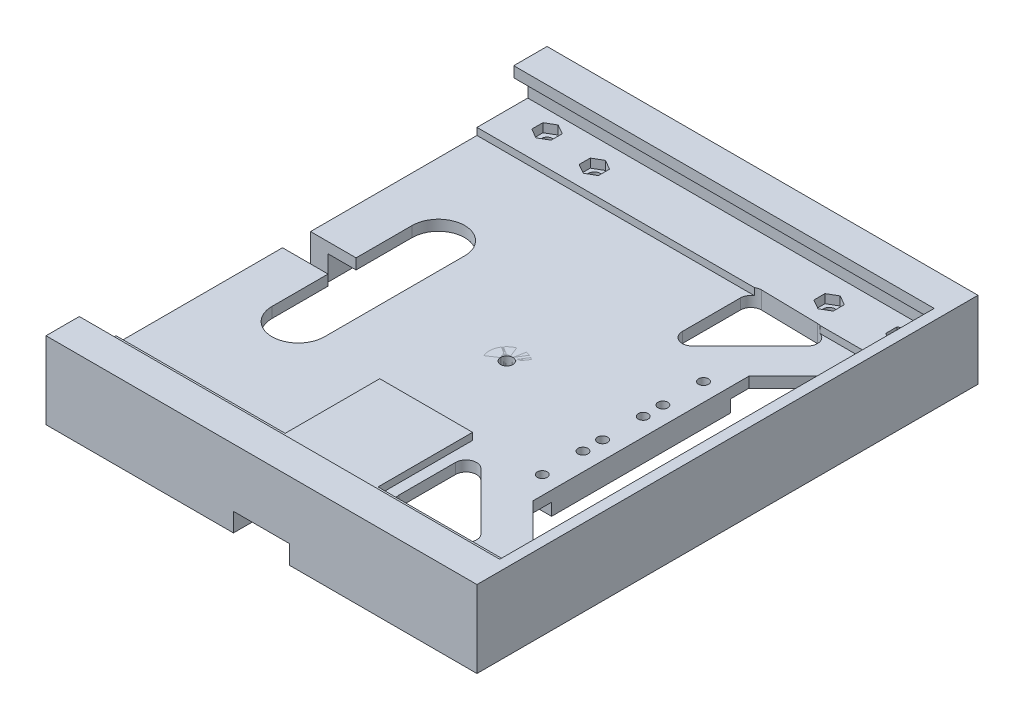
from build123d import *

# Parameters (mm, degrees)
SKETCH1_W                = 120
SKETCH1_H                = 20
BOSS_EXTRUDE1_DEPTH      = 12
SKETCH2_W                = 120
SKETCH2_H                = 9.5
BOSS_EXTRUDE2_DEPTH      = 10
CUT_EXTRUDE1_REACH       = 124.409
SKETCH3_W                = 4
SKETCH3_H                = 7
SKETCH4_W                = 76
SKETCH4_H                = 20
CUT_EXTRUDE2_DEPTH       = 7
SKETCH7_W                = 120
SKETCH7_H                = 10
BOSS_EXTRUDE3_DEPTH      = 123
SKETCH8_W                = 120
SKETCH8_H                = 20
BOSS_EXTRUDE4_DEPTH      = 2
SKETCH10_W               = 120
SKETCH10_H               = 6.5
BOSS_EXTRUDE5_DEPTH      = 7
SKETCH11_W               = 120
SKETCH11_H               = 9.5
BOSS_EXTRUDE6_DEPTH      = 3
SKETCH13_W               = 143
SKETCH13_H               = 22
BOSS_EXTRUDE7_DEPTH      = 3
CUT_EXTRUDE5_DEPTH       = 7
SKETCH16_W               = 20.8
SKETCH16_H               = 1.65
CUT_EXTRUDE6_DEPTH       = 16.5
SKETCH17_W               = 16
SKETCH17_H               = 5.35
CUT_EXTRUDE7_DEPTH       = 142.696859528
CUT_EXTRUDE8_DEPTH       = 2.75
CUT_EXTRUDE9_DEPTH       = 148.929037041
CUT_EXTRUDE9_DEPTH_BACK  = 148.929037041
SKETCH22_W               = 26.5
SKETCH22_H               = 31
BOSS_EXTRUDE8_DEPTH      = 2
CUT_EXTRUDE11_REACH      = 149.929
SKETCH27_R               = 1.75
SKETCH20_R               = 5
BOSS_EXTRUDE9_DEPTH      = 8
CUT_EXTRUDE13_DEPTH      = 2.5
CUT_EXTRUDE14_DEPTH      = 149.519359008
CUT_EXTRUDE14_DEPTH_BACK = 149.519359008
SKETCH31_R               = 1.75
SKETCH32_W               = 10.3
SKETCH32_H               = 51
BOSS_EXTRUDE10_DEPTH     = 3.5
SKETCH33_R               = 1.4
CUT_EXTRUDE15_DEPTH      = 149.324812489
SKETCH38_R               = 1.55
CUT_EXTRUDE19_DEPTH      = 12
CUT_EXTRUDE20_DEPTH      = 2.5
CUT_EXTRUDE21_DEPTH      = 148.655003302
CUT_EXTRUDE21_DEPTH_BACK = 148.655003302


with BuildPart() as part:
    # Sketch1 → Boss-Extrude1 (new body)
    with BuildSketch(Plane(origin=(0, 0, 0), x_dir=(1, 0, 0), z_dir=(0, 1, 0))):
        Rectangle(SKETCH1_W, SKETCH1_H)
    extrude(amount=BOSS_EXTRUDE1_DEPTH)

    # Sketch2 → Boss-Extrude2 (add)
    with BuildSketch(Plane(origin=(0, 12, 0), x_dir=(1, 0, 0), z_dir=(0, 1, 0))):
        with Locations((0, 5.25)):
            Rectangle(SKETCH2_W, SKETCH2_H)
    extrude(amount=BOSS_EXTRUDE2_DEPTH)

    # Sketch3 → Cut-Extrude1 (cut, up to next)
    with BuildSketch(Plane(origin=(60, 0, 0), x_dir=(0, 0, -1), z_dir=(1, 0, 0)), mode=Mode.PRIVATE) as cut_extrude1_sk1:
        with Locations((2.5, 15.5)):
            Rectangle(SKETCH3_W, SKETCH3_H)
    cut_extrude1_tool1 = extrude(cut_extrude1_sk1.sketch, amount=-CUT_EXTRUDE1_REACH, mode=Mode.PRIVATE) & part.part
    add(cut_extrude1_tool1.solids().sort_by_distance((60, 15.5, -2.5))[0], mode=Mode.SUBTRACT)

    # Sketch4 → Cut-Extrude2 (cut)
    with BuildSketch(Plane.XZ):
        Rectangle(SKETCH4_W, SKETCH4_H)
    extrude(amount=-CUT_EXTRUDE2_DEPTH, mode=Mode.SUBTRACT)

    # Sketch7 → Boss-Extrude3 (add)
    with BuildSketch(Plane.XY.offset(10)):
        with Locations((0, 5)):
            Rectangle(SKETCH7_W, SKETCH7_H)
    extrude(amount=BOSS_EXTRUDE3_DEPTH)

    # Sketch8 → Boss-Extrude4 (add)
    with BuildSketch(Plane(origin=(0, 10, 0), x_dir=(1, 0, 0), z_dir=(0, 1, 0))):
        with Locations((0, -123)):
            Rectangle(SKETCH8_W, SKETCH8_H)
    extrude(amount=BOSS_EXTRUDE4_DEPTH)



with BuildPart() as body_2:
    # Sketch10 → Boss-Extrude5 (new body)
    with BuildSketch(Plane(origin=(0, 12, 0), x_dir=(1, 0, 0), z_dir=(0, 1, 0))):
        with Locations((0, -129.75)):
            Rectangle(SKETCH10_W, SKETCH10_H)
    extrude(amount=BOSS_EXTRUDE5_DEPTH)


with BuildPart() as part_1:
    add(part.part)

    add(body_2.part)  # Boss-Extrude6 merges body 2
    # Sketch11 → Boss-Extrude6 (add)
    with BuildSketch(Plane(origin=(0, 19, 0), x_dir=(1, 0, 0), z_dir=(0, 1, 0))):
        with Locations((0, -128.25)):
            Rectangle(SKETCH11_W, SKETCH11_H)
    extrude(amount=BOSS_EXTRUDE6_DEPTH)

    # Sketch13 → Boss-Extrude7 (add)
    with BuildSketch(Plane(origin=(60, 0, 0), x_dir=(0, 0, -1), z_dir=(1, 0, 0))):
        with Locations((-61.5, 11)):
            Rectangle(SKETCH13_W, SKETCH13_H)
    extrude(amount=BOSS_EXTRUDE7_DEPTH)

    # Sketch14 → Cut-Extrude5 (cut)
    with BuildSketch(Plane.XZ):
        Polygon((-38, 10), (-55, 10), (-55, 115), (58, 115), (58, 10), (38, 10), align=None)
    extrude(amount=-CUT_EXTRUDE5_DEPTH, mode=Mode.SUBTRACT)

    # Sketch16 → Cut-Extrude6 (cut)
    with BuildSketch(Plane(origin=(0, 0, 115), x_dir=(-1, 0, 0), z_dir=(0, 0, -1))):
        with Locations((-1.5, 6.175)):
            Rectangle(SKETCH16_W, SKETCH16_H)
    extrude(amount=-CUT_EXTRUDE6_DEPTH, mode=Mode.SUBTRACT)

    # Sketch17 → Cut-Extrude7 (cut, through all)
    with BuildSketch(Plane(origin=(0, 0, 115), x_dir=(-1, 0, 0), z_dir=(0, 0, -1))):
        with Locations((-1.5, 2.675)):
            Rectangle(SKETCH17_W, SKETCH17_H)
    extrude(amount=-CUT_EXTRUDE7_DEPTH, mode=Mode.SUBTRACT)

    # Sketch18 → Cut-Extrude8 (cut)
    with BuildSketch(Plane.XZ.offset(-7)):
        Polygon((-6.5, 131.5), (9.5, 131.5), (9.5, 115), (11.75, 115), (11.75, 89), (-8.75, 89), (-8.75, 115), (-6.5, 115), align=None)
    extrude(amount=-CUT_EXTRUDE8_DEPTH, mode=Mode.SUBTRACT)

    # Sketch19 → Cut-Extrude9 (cut, two sides: drawn at the far end of the back side and taken through both)
    with BuildSketch(Plane.XZ.offset(-7).offset(-CUT_EXTRUDE9_DEPTH_BACK)):
        with BuildLine():
            Line((-47, 57.5), (-60, 57.5))
            ThreePointArc((-60, 57.5), (-64, 61.5), (-60, 65.5))
            Line((-60, 65.5), (-47, 65.5))
            Line((-47, 65.5), (-47, 81.5))
            ThreePointArc((-47, 81.5), (-39.5, 89), (-32, 81.5))
            Line((-32, 81.5), (-32, 41.5))
            ThreePointArc((-32, 41.5), (-39.5, 34), (-47, 41.5))
            Line((-47, 41.5), (-47, 57.5))
        make_face()
    extrude(amount=CUT_EXTRUDE9_DEPTH + CUT_EXTRUDE9_DEPTH_BACK, mode=Mode.SUBTRACT)

    # Sketch22 → Boss-Extrude8 (add)
    with BuildSketch(Plane(origin=(0, 10, 0), x_dir=(1, 0, 0), z_dir=(0, 1, 0))):
        with Locations((1.5, -101.5)):
            Rectangle(SKETCH22_W, SKETCH22_H)
    extrude(amount=BOSS_EXTRUDE8_DEPTH)

    # Sketch27 → Cut-Extrude11 (cut, up to next)
    with BuildSketch(Plane.XZ.offset(-7), mode=Mode.PRIVATE) as cut_extrude11_sk1:
        with Locations(Location((33.5, 3, 0), (0, 0, 270))):
            Circle(SKETCH27_R)
    cut_extrude11_tool1 = extrude(cut_extrude11_sk1.sketch, amount=-CUT_EXTRUDE11_REACH, mode=Mode.PRIVATE) & part_1.part
    # Sketch27 → Cut-Extrude11 (cut, up to next)
    with BuildSketch(Plane.XZ.offset(-7), mode=Mode.PRIVATE) as cut_extrude11_sk2:
        with Locations(Location((-33.5, 3, 0), (0, 0, 270))):
            Circle(SKETCH27_R)
    cut_extrude11_tool2 = extrude(cut_extrude11_sk2.sketch, amount=-CUT_EXTRUDE11_REACH, mode=Mode.PRIVATE) & part_1.part
    add(cut_extrude11_tool1.solids().sort_by_distance((33.5, 7, 3))[0], mode=Mode.SUBTRACT)
    add(cut_extrude11_tool2.solids().sort_by_distance((-33.5, 7, 3))[0], mode=Mode.SUBTRACT)


with BuildPart() as body_2_2:
    # Sketch20 → Boss-Extrude9 (new body)
    with BuildSketch(Plane.XZ.offset(-10)):
        with Locations(Location((0, 61.5, 0), (0, 0, 270))):
            Circle(SKETCH20_R)
    extrude(amount=BOSS_EXTRUDE9_DEPTH)

    # Sketch29 → Cut-Extrude13 (cut)
    with BuildSketch(Plane.XZ.offset(-2)):
        Polygon((2.75, 63.08771324), (0, 64.675426481), (-2.75, 63.08771324), (-2.75, 59.91228676), (0, 58.324573519), (2.75, 59.91228676), align=None)
    extrude(amount=-CUT_EXTRUDE13_DEPTH, mode=Mode.SUBTRACT)


with BuildPart() as cut_extrude14_tool:
    # Sketch31 → Cut-Extrude14 (new, two sides: drawn at the far end of the back side and taken through both)
    with BuildSketch(Plane.XZ.offset(-2).offset(-CUT_EXTRUDE14_DEPTH_BACK)):
        with Locations(Location((0, 61.5, 0), (0, 0, 270))):
            Circle(SKETCH31_R)
    extrude(amount=CUT_EXTRUDE14_DEPTH + CUT_EXTRUDE14_DEPTH_BACK)


with BuildPart() as part_2:
    add(part_1.part)

    # Cut-Extrude14: cut by cut_extrude14_tool
    add(cut_extrude14_tool.part, mode=Mode.SUBTRACT)

    # Sketch32 → Boss-Extrude10 (add)
    with BuildSketch(Plane.XZ.offset(-7)):
        with Locations((33.15, 61.5)):
            Rectangle(SKETCH32_W, SKETCH32_H)
    extrude(amount=BOSS_EXTRUDE10_DEPTH)

    # Sketch33 → Cut-Extrude15 (cut, through all)
    with BuildSketch(Plane.XZ.offset(-3.5)):
        with Locations(Location((33.15, 38.5, 0), (0, 0, 270))):
            Circle(SKETCH33_R)
        with Locations(Location((33.15, 50.1, 0), (0, 0, 270))):
            Circle(SKETCH33_R)
        with Locations(Location((33.15, 72.9, 0), (0, 0, 270))):
            Circle(SKETCH33_R)
        with Locations(Location((33.15, 84.5, 0), (0, 0, 270))):
            Circle(SKETCH33_R)
        with Locations(Location((33.15, 55.7, 0), (0, 0, 270))):
            Circle(SKETCH33_R)
        with Locations(Location((33.15, 67.3, 0), (0, 0, 270))):
            Circle(SKETCH33_R)
    extrude(amount=-CUT_EXTRUDE15_DEPTH, mode=Mode.SUBTRACT)

    # Sketch38 → Cut-Extrude19 (cut)
    with BuildSketch(Plane.XZ):
        with Locations(Location((-49, 122, 0), (0, 0, 270))):
            Circle(SKETCH38_R)
        with Locations(Location((52, 122, 0), (0, 0, 270))):
            Circle(SKETCH38_R)
        with Locations(Location((52, 1, 0), (0, 0, 270))):
            Circle(SKETCH38_R)
        with Locations(Location((-49, 1, 0), (0, 0, 270))):
            Circle(SKETCH38_R)
    extrude(amount=-CUT_EXTRUDE19_DEPTH, mode=Mode.SUBTRACT)

    # Sketch39 → Cut-Extrude20 (cut)
    with BuildSketch(Plane(origin=(0, 12, 0), x_dir=(1, 0, 0), z_dir=(0, 1, 0))):
        Polygon((-46.25, -2.58771324), (-46.25, 0.58771324), (-49, 2.175426481), (-51.75, 0.58771324), (-51.75, -2.58771324), (-49, -4.175426481), align=None)
        Polygon((-30.75, -4.58771324), (-30.75, -1.41228676), (-33.5, 0.175426481), (-36.25, -1.41228676), (-36.25, -4.58771324), (-33.5, -6.175426481), align=None)
        Polygon((33.5, -6.175426481), (36.25, -4.58771324), (36.25, -1.41228676), (33.5, 0.175426481), (30.75, -1.41228676), (30.75, -4.58771324), align=None)
        Polygon((52, -4.175426481), (54.75, -2.58771324), (54.75, 0.58771324), (52, 2.175426481), (49.25, 0.58771324), (49.25, -2.58771324), align=None)
        Polygon((54.75, -120.41228676), (52, -118.824573519), (49.25, -120.41228676), (49.25, -123.58771324), (52, -125.175426481), (54.75, -123.58771324), align=None)
        Polygon((-46.25, -120.41228676), (-49, -118.824573519), (-51.75, -120.41228676), (-51.75, -123.58771324), (-49, -125.175426481), (-46.25, -123.58771324), align=None)
    extrude(amount=-CUT_EXTRUDE20_DEPTH, mode=Mode.SUBTRACT)

    # Sketch40 → Cut-Extrude21 (cut, two sides: drawn at the far end of the back side and taken through both)
    with BuildSketch(Plane(origin=(0, 10, 0), x_dir=(1, 0, 0), z_dir=(0, 1, 0)).offset(-CUT_EXTRUDE21_DEPTH_BACK)):
        Polygon((50, -104), (50, -19), (38.3, -30.680947351), (38.3, -92.319052649), align=None)
        with BuildLine():
            Line((17.75, -93.873976136), (17.75, -110))
            ThreePointArc((17.75, -110), (18.628679656, -112.121320344), (20.75, -113))
            Line((20.75, -113), (36.902326822, -113))
            ThreePointArc((36.902326822, -113), (39.674432951, -111.146920927), (39.021917842, -107.876951741))
            Line((39.021917842, -107.876951741), (22.86959102, -91.750927878))
            ThreePointArc((22.86959102, -91.750927878), (19.600820523, -91.10280553), (17.75, -93.873976136))
        make_face()
        with BuildLine():
            Line((17.75, -12.5573489), (17.75, -29.126023864))
            ThreePointArc((17.75, -29.126023864), (19.600820523, -31.89719447), (22.86959102, -31.249072122))
            Line((22.86959102, -31.249072122), (39.156365064, -14.988819975))
            ThreePointArc((39.156365064, -14.988819975), (39.819614107, -11.745146363), (37.093574893, -9.866309488))
            Line((37.093574893, -9.866309488), (20.806800849, -9.557886671))
            ThreePointArc((20.806800849, -9.557886671), (18.648857757, -10.416040591), (17.75, -12.5573489))
        make_face()
    extrude(amount=CUT_EXTRUDE21_DEPTH + CUT_EXTRUDE21_DEPTH_BACK, mode=Mode.SUBTRACT)


with BuildPart() as body_2_2_1:
    add(body_2_2.part)

    # Cut-Extrude14: cut by cut_extrude14_tool
    add(cut_extrude14_tool.part, mode=Mode.SUBTRACT)


solid = Compound([part_2.part, body_2_2_1.part])
